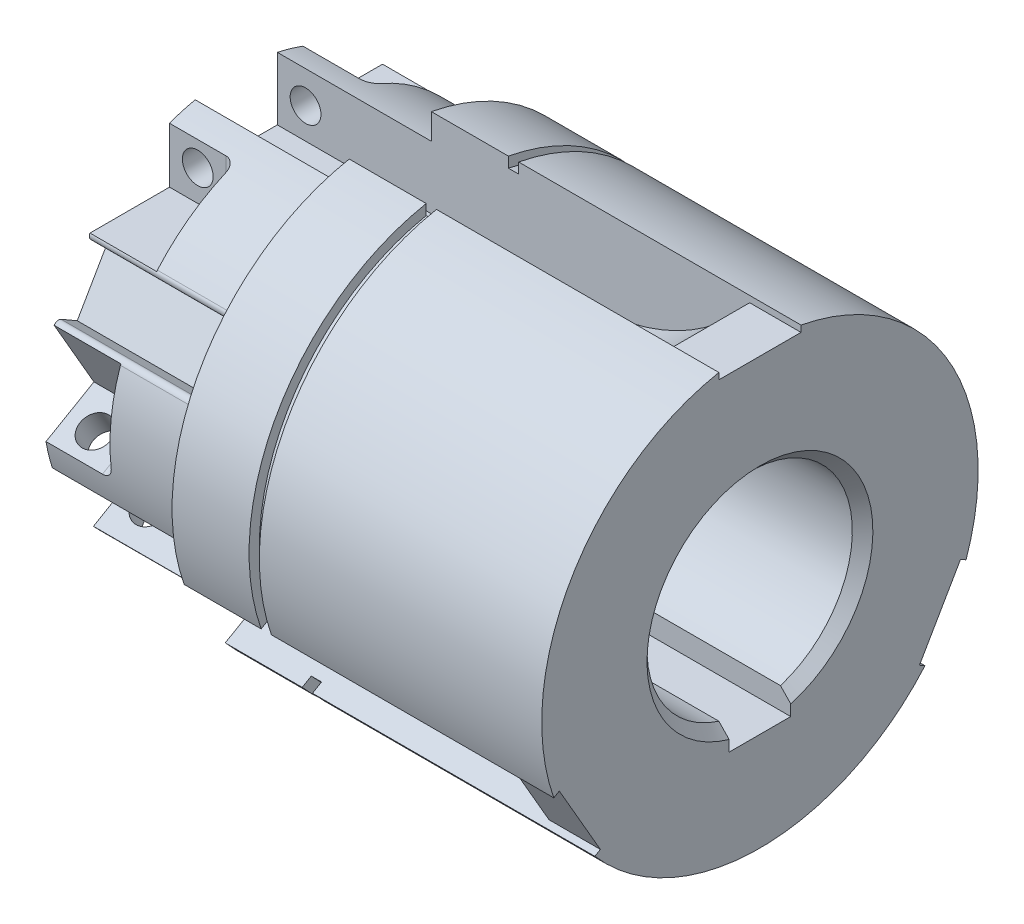
from build123d import *

# Parameters (mm, degrees)
CUT_EXTRUDE1_DEPTH       = 8
CIRPATTERN1_COUNT        = 3
CUT_EXTRUDE2_DEPTH       = 13
FILLET1_R                = 2
CUT_EXTRUDE3_REACH       = 125.655
SKETCH6_R                = 3
CIRPATTERN2_COUNT        = 3
FILLET1_OF_CIRPATTERN2_R = 2
CUT_EXTRUDE4_DEPTH       = 30
FILLET2_R                = 1
CIRPATTERN3_COUNT        = 3
FILLET2_OF_CIRPATTERN3_R = 1
CUT_EXTRUDE5_REACH       = 130.22
SKETCH9_W                = 102
SKETCH9_H                = 12
CHAMFER2_SIZE            = 2


with BuildPart() as part:
    # Sketch1 → Revolve1 (revolve)
    with BuildSketch(Plane.XY, mode=Mode.PRIVATE) as revolve1_sk:
        Polygon((0, 20), (0, 42.5), (-55, 42.5), (-55, 40.5), (-57, 40.5), (-57, 42.5), (-72, 42.5), (-72, 37.6), (-102, 37.6), (-102, 20), align=None)
    revolve(revolve1_sk.sketch.rotate(Axis((-534.701035213, 0, 0), (1, 0, 0)), 90), axis=Axis((-534.701035213, 0, 0), (1, 0, 0)))

    # Sketch3 → Cut-Extrude1 (cut, symmetric)
    with BuildSketch(Plane.XY):
        with BuildLine():
            Line((-102, 24.5), (-42, 24.5))
            ThreePointArc((-42, 24.5), (-24.11145618, 28.72291236), (-10, 40.5))
            Line((-10, 40.5), (0, 40.5))
            Line((0, 40.5), (0, 42.5))
            Line((0, 42.5), (-55, 42.5))
            Line((-55, 42.5), (-55, 40.5))
            Line((-55, 40.5), (-57, 40.5))
            Line((-57, 40.5), (-57, 42.5))
            Line((-57, 42.5), (-72, 42.5))
            Line((-72, 42.5), (-72, 37.6))
            Line((-72, 37.6), (-102, 37.6))
            Line((-102, 37.6), (-102, 24.5))
        make_face()
    cut_extrude1 = extrude(amount=CUT_EXTRUDE1_DEPTH, both=True, mode=Mode.SUBTRACT)

    # CirPattern1: Cut-Extrude1 ×3 about axis
    cirpattern1_axis = Axis((0, 0, 0), (1, 0, 0))
    for i in range(1, CIRPATTERN1_COUNT):
        add(cut_extrude1.rotate(cirpattern1_axis, i * 360 / CIRPATTERN1_COUNT), mode=Mode.SUBTRACT)

    # Sketch4 → Cut-Extrude2 (cut)
    with BuildSketch(Plane.ZY.offset(102)):
        with BuildLine():
            Line((-13, 35.281156444), (-13, 24.5))
            Line((-13, 24.5), (-28.522096697, 24.5))
            ThreePointArc((-28.522096697, 24.5), (-21.449462979, 30.881718506), (-13, 35.281156444))
        make_face()
        with BuildLine():
            Line((13, 35.281156444), (13, 24.5))
            Line((13, 24.5), (28.522096697, 24.5))
            ThreePointArc((28.522096697, 24.5), (21.449462979, 30.881718506), (13, 35.281156444))
        make_face()
    cut_extrude2 = extrude(amount=-CUT_EXTRUDE2_DEPTH, mode=Mode.SUBTRACT)

    # Fillet1
    fillet1_edges = [part.edges().sort_by_distance(p)[0] for p in [
        (-89, 29.890578222, -13),
        (-89, 29.890578222, 13),
    ]]
    fillet(fillet1_edges, radius=FILLET1_R)

    # Cut-Extrude3: up to this face of the body (flat: up to its plane)
    cut_extrude3_end = Plane(part.part.faces().sort_by_distance((-96.5, 29.890578222, -13))[0])
    # Sketch6 → Cut-Extrude3 (cut, up to the picked face)
    with BuildSketch(Plane.XY.offset(13), mode=Mode.PRIVATE) as cut_extrude3_sk1:
        with Locations((-96.5, 30.5)):
            Circle(SKETCH6_R)
    cut_extrude3_tool1 = split(extrude(cut_extrude3_sk1.sketch, amount=-CUT_EXTRUDE3_REACH, mode=Mode.PRIVATE), bisect_by=cut_extrude3_end, keep=Keep.BOTH, mode=Mode.PRIVATE)
    cut_extrude3 = cut_extrude3_tool1.solids().sort_by(Axis((-96.5, 30.5, 13), (0, 0, -1)))[0]
    add(cut_extrude3, mode=Mode.SUBTRACT)

    # CirPattern2: Cut-Extrude2, Cut-Extrude3 ×3 about axis
    cirpattern2_axis = Axis((0, 0, 0), (1, 0, 0))
    add([cut_extrude2.rotate(cirpattern2_axis, i * 360 / CIRPATTERN2_COUNT) for i in range(1, CIRPATTERN2_COUNT)], mode=Mode.SUBTRACT)
    add([cut_extrude3.rotate(cirpattern2_axis, i * 360 / CIRPATTERN2_COUNT) for i in range(1, CIRPATTERN2_COUNT)], mode=Mode.SUBTRACT)

    # Fillet1 of CirPattern2
    fillet1_of_cirpattern2_edges = [part.edges().sort_by_distance(p)[0] for p in [
        (-89, -3.686958862, 32.386000074),
        (-89, -26.20361936, 19.386000074),
        (-89, -26.20361936, -19.386000074),
        (-89, -3.686958862, -32.386000074),
    ]]
    fillet(fillet1_of_cirpattern2_edges, radius=FILLET1_OF_CIRPATTERN2_R)

    # Sketch7 → Cut-Extrude4 (cut)
    with BuildSketch(Plane.ZY.offset(102)):
        with BuildLine():
            Line((-6, -37.118189611), (-6, -32.3))
            Line((-6, -32.3), (6, -32.3))
            Line((6, -32.3), (6, -37.118189611))
            ThreePointArc((6, -37.118189611), (0, -37.6), (-6, -37.118189611))
        make_face()
    cut_extrude4 = extrude(amount=-CUT_EXTRUDE4_DEPTH, mode=Mode.SUBTRACT)

    # Fillet2
    fillet2_edges = [part.edges().sort_by_distance(p)[0] for p in [
        (-87, -37.118189611, 6),
        (-87, -37.118189611, -6),
    ]]
    fillet(fillet2_edges, radius=FILLET2_R)

    # CirPattern3: Cut-Extrude4 ×3 about axis
    cirpattern3_axis = Axis((0, 0, 0), (1, 0, 0))
    for i in range(1, CIRPATTERN3_COUNT):
        add(cut_extrude4.rotate(cirpattern3_axis, i * 360 / CIRPATTERN3_COUNT), mode=Mode.SUBTRACT)

    # Fillet2 of CirPattern3
    fillet2_of_cirpattern3_edges = [part.edges().sort_by_distance(p)[0] for p in [
        (-87, 13.362942383, -35.145295146),
        (-87, 23.755247228, -29.145295146),
        (-87, 23.755247228, 29.145295146),
        (-87, 13.362942383, 35.145295146),
    ]]
    fillet(fillet2_of_cirpattern3_edges, radius=FILLET2_OF_CIRPATTERN3_R)

    # Sketch9 → Cut-Extrude5 (cut, up to next)
    with BuildSketch(Plane(origin=(0, -23.3, 0), x_dir=(1, 0, 0), z_dir=(0, 1, 0)), mode=Mode.PRIVATE) as cut_extrude5_sk1:
        with Locations((-51, 0)):
            Rectangle(SKETCH9_W, SKETCH9_H)
    cut_extrude5_tool1 = extrude(cut_extrude5_sk1.sketch, amount=CUT_EXTRUDE5_REACH, mode=Mode.PRIVATE) & part.part
    add(cut_extrude5_tool1.solids().sort_by_distance((-51, -23.3, 0))[0], mode=Mode.SUBTRACT)

    # Chamfer2
    chamfer2_edges = [part.edges().sort_by_distance(p)[0] for p in [
        (0, 20, 0),
        (-102, 20, 0),
    ]]
    chamfer(chamfer2_edges, length=CHAMFER2_SIZE)


solid = part.part
